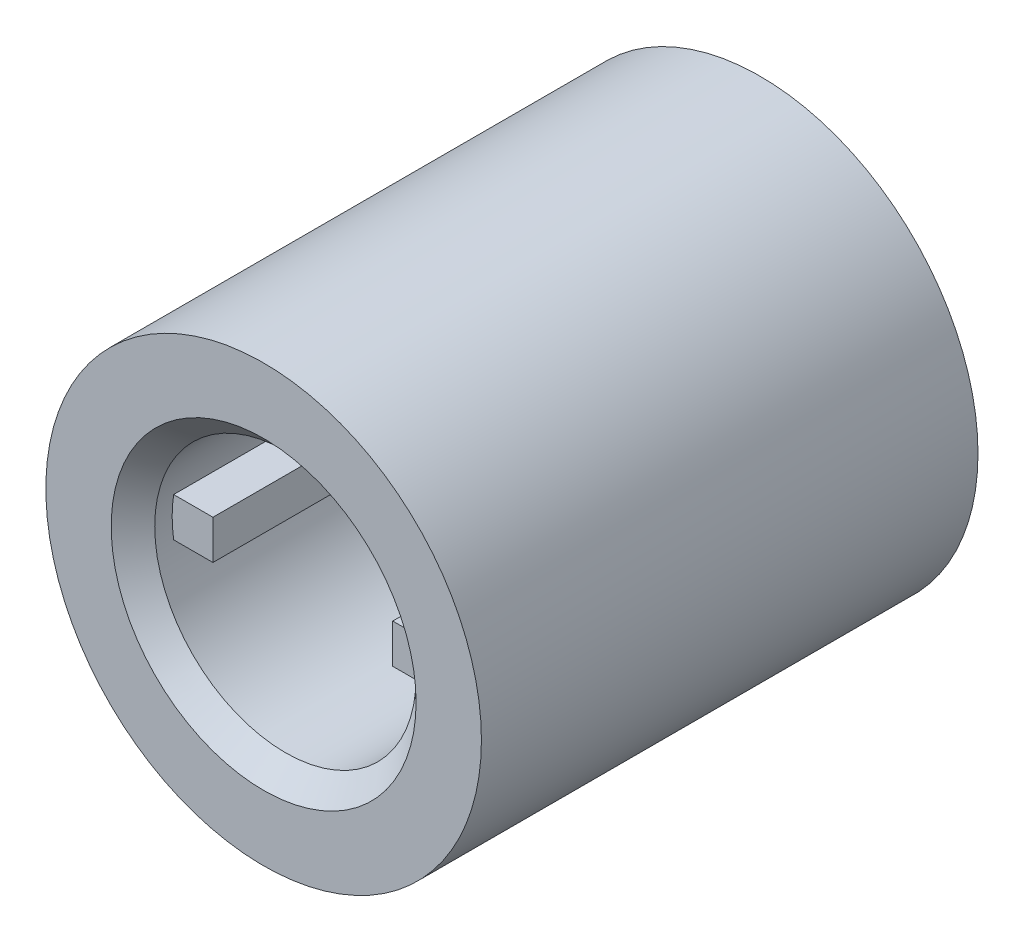
from build123d import *

# Parameters (mm, degrees)
EXTRUDE_1_DEPTH      = 3.9
EXTRUDE_1_DEPTH_BACK = 7.5
SKETCH_1_R           = 5
SKETCH_1_R_2         = 3
CHAMFER_1_SIZE       = 0.5
SKETCH_2_W           = 1.242269364
SKETCH_2_H           = 0.9
EXTRUDE_1_2_DEPTH    = 3


with BuildPart() as part:
    # 草图1 → Extrude 1 (new, two sides: drawn at the far end of the back side and taken through both)
    with BuildSketch(Plane.XY.offset(-EXTRUDE_1_DEPTH_BACK)):
        Circle(SKETCH_1_R)
        Circle(SKETCH_1_R_2, mode=Mode.SUBTRACT)
    extrude(amount=EXTRUDE_1_DEPTH + EXTRUDE_1_DEPTH_BACK)

    # 倒角1
    chamfer_1_edges = [part.edges().sort_by_distance(p)[0] for p in [
        (-3, 0, -7.5),
        (-3, 0, 3.9),
    ]]
    chamfer(chamfer_1_edges, length=CHAMFER_1_SIZE)

    # 草图2 → Extrude 1 2 (add)
    with BuildSketch(Plane.XY):
        with Locations((-2.68480736, 0)):
            Rectangle(SKETCH_2_W, SKETCH_2_H)
        with Locations((2.68480736, 0)):
            Rectangle(SKETCH_2_W, SKETCH_2_H)
    extrude(amount=EXTRUDE_1_2_DEPTH)


solid = part.part
